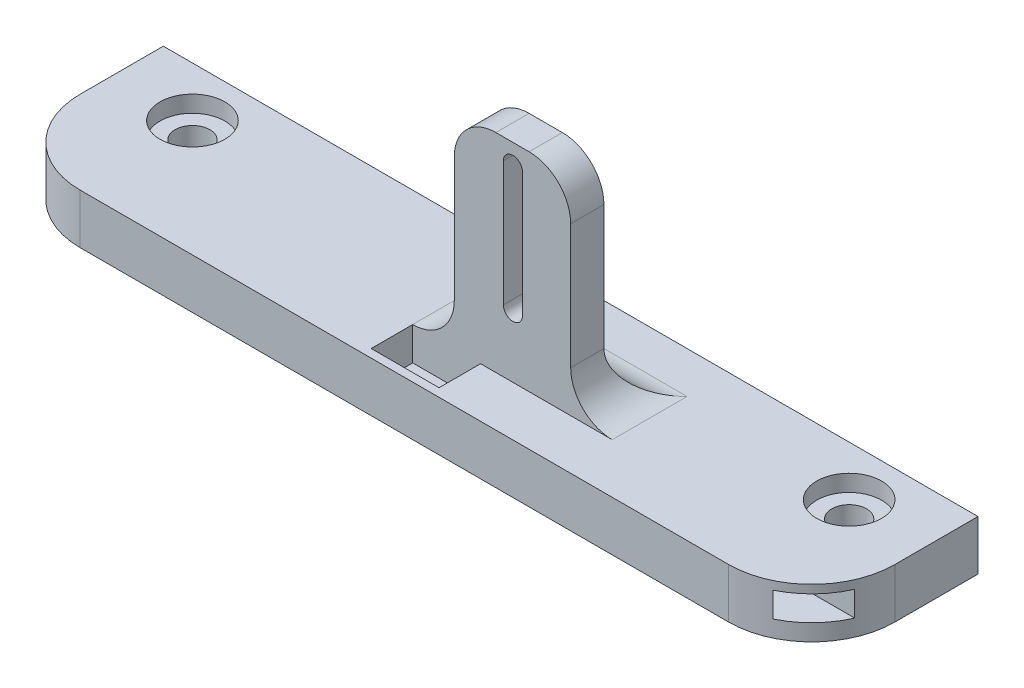
from build123d import *

# Parameters (mm, degrees)
CROQUIS1_R              = 2.1
SALIENTE_EXTRUIR1_DEPTH = 6
CROQUIS2_R              = 3.9
CORTAR_EXTRUIR1_DEPTH   = 2
CROQUIS3_W              = 14
CROQUIS3_H              = 4
SALIENTE_EXTRUIR2_DEPTH = 25
REDONDEO4_R             = 5
CORTAR_EXTRUIR6_DEPTH   = 4
REDONDEO7_R             = 5
REDONDEO8_R             = 5
CROQUIS5_W              = 5
CROQUIS5_H              = 8
CORTAR_EXTRUIR9_DEPTH   = 54
CROQUIS11_W             = 45
CROQUIS11_H             = 0.996592172
SALIENTE_EXTRUIR7_DEPTH = 5
CORTAR_EXTRUIR10_START  = -5
CORTAR_EXTRUIR10_DEPTH  = 5


with BuildPart() as part:
    # Croquis1 → Saliente-Extruir1 (new body)
    with BuildSketch(Plane(origin=(0, 0, 0), x_dir=(1, 0, 0), z_dir=(0, 1, 0))):
        with BuildLine():
            Line((-39, -10), (39, -10))
            ThreePointArc((39, -10), (46.071067812, -7.071067812), (49, 0))
            Line((49, 0), (49, 10))
            Line((49, 10), (-49, 10))
            Line((-49, 10), (-49, 0))
            ThreePointArc((-49, 0), (-46.071067812, -7.071067812), (-39, -10))
        make_face()
        with Locations(Location((-39.5, 4, 0), (0, 0, 270))):
            Circle(CROQUIS1_R, mode=Mode.SUBTRACT)
        with Locations(Location((39.5, 4, 0), (0, 0, 270))):
            Circle(CROQUIS1_R, mode=Mode.SUBTRACT)
    extrude(amount=SALIENTE_EXTRUIR1_DEPTH)

    # Croquis2 → Cortar-Extruir1 (cut)
    with BuildSketch(Plane(origin=(0, 6, 0), x_dir=(1, 0, 0), z_dir=(0, 1, 0))):
        with Locations(Location((39.5, 4, 0), (0, 0, 270))):
            Circle(CROQUIS2_R)
        with Locations(Location((-39.5, 4, 0), (0, 0, 270))):
            Circle(CROQUIS2_R)
    extrude(amount=-CORTAR_EXTRUIR1_DEPTH, mode=Mode.SUBTRACT)

    # Croquis3 → Saliente-Extruir2 (add)
    with BuildSketch(Plane(origin=(0, 6, 0), x_dir=(1, 0, 0), z_dir=(0, 1, 0))):
        with Locations((7, -2)):
            Rectangle(CROQUIS3_W, CROQUIS3_H)
    extrude(amount=SALIENTE_EXTRUIR2_DEPTH)

    # Redondeo4
    redondeo4_edges = [part.edges().sort_by_distance(p)[0] for p in [
        (7, 6, 0),
        (0, 6, 2),
        (14, 6, 2),
    ]]
    fillet(redondeo4_edges, radius=REDONDEO4_R)

    # Croquis4 → Cortar-Extruir6 (cut)
    with BuildSketch(Plane(origin=(0, 0, 0), x_dir=(-1, 0, 0), z_dir=(0, 0, -1))):
        with BuildLine():
            Line((-5.9, 28.5), (-5.9, 13.5))
            ThreePointArc((-5.9, 13.5), (-7.05, 12.35), (-8.2, 13.5))
            Line((-8.2, 13.5), (-8.2, 28.5))
            ThreePointArc((-8.2, 28.5), (-7.05, 29.65), (-5.9, 28.5))
        make_face()
    extrude(amount=-CORTAR_EXTRUIR6_DEPTH, mode=Mode.SUBTRACT)

    # Redondeo7
    redondeo7_edges = [part.edges().sort_by_distance(p)[0] for p in [
        (14, 31, 2),
    ]]
    fillet(redondeo7_edges, radius=REDONDEO7_R)

    # Redondeo8
    redondeo8_edges = [part.edges().sort_by_distance(p)[0] for p in [
        (0, 31, 2),
    ]]
    fillet(redondeo8_edges, radius=REDONDEO8_R)

    # Croquis5 → Cortar-Extruir9 (cut)
    with BuildSketch(Plane(origin=(49, 0, 0), x_dir=(0, 0, -1), z_dir=(1, 0, 0))):
        with Locations((-6.5, 6)):
            Rectangle(CROQUIS5_W, CROQUIS5_H)
    extrude(amount=-CORTAR_EXTRUIR9_DEPTH, mode=Mode.SUBTRACT)

    # Croquis11 → Saliente-Extruir7 (add)
    with BuildSketch(Plane.XY.offset(4)):
        with Locations((25.66515139, 5.501703914)):
            Rectangle(CROQUIS11_W, CROQUIS11_H)
    extrude(amount=SALIENTE_EXTRUIR7_DEPTH)

    # Croquis12 → Cortar-Extruir10 (cut)
    with BuildSketch(Plane(origin=(0, 6, 0), x_dir=(1, 0, 0), z_dir=(0, 1, 0)).offset(CORTAR_EXTRUIR10_START)):
        with BuildLine():
            Line((49, 10), (57.140229863, 10))
            Line((57.140229863, 10), (57.737940114, -14.066484251))
            Line((57.737940114, -14.066484251), (14, -12.561195781))
            Line((14, -12.561195781), (14, -10))
            Line((14, -10), (39, -10))
            ThreePointArc((39, -10), (46.071067812, -7.071067812), (49, 0))
            Line((49, 0), (49, 10))
        make_face()
    extrude(amount=CORTAR_EXTRUIR10_DEPTH, mode=Mode.SUBTRACT)


solid = part.part
